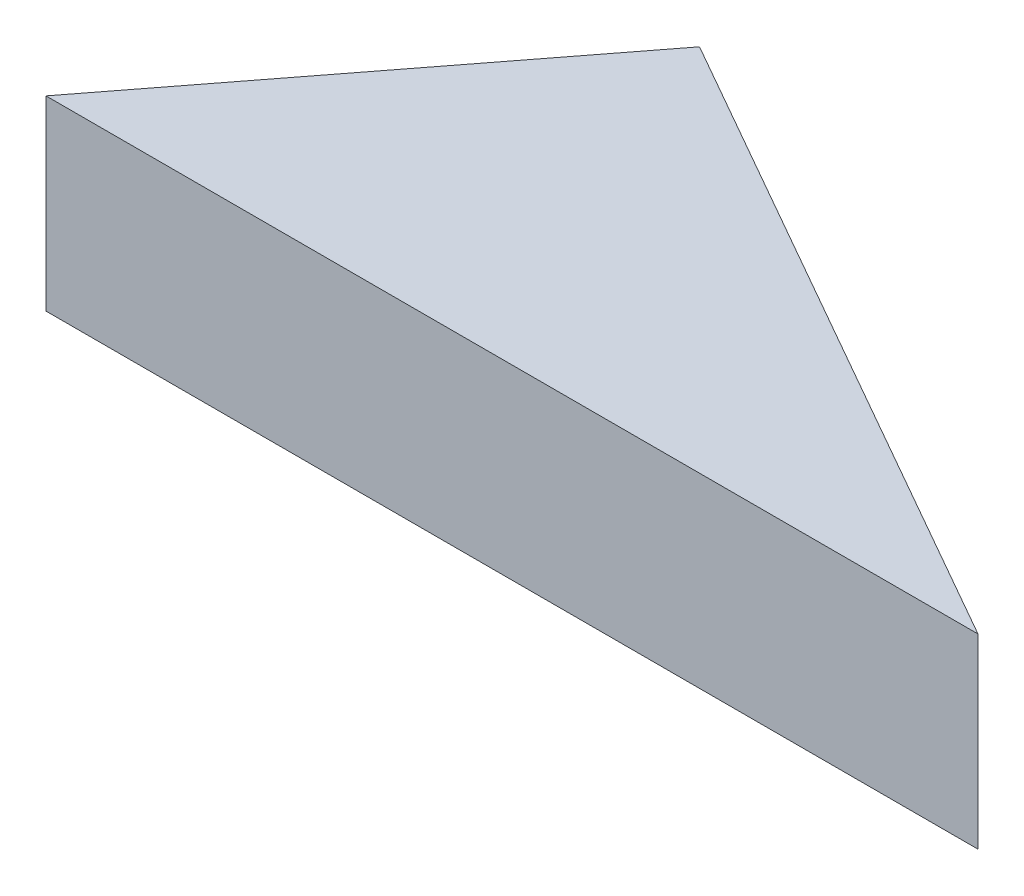
from build123d import *

# Parameters (mm, degrees)
BOSS_EXTRUDE1_DEPTH = 10


with BuildPart() as part:
    # Sketch1 → Boss-Extrude1 (new body)
    with BuildSketch(Plane(origin=(0, 0, 0), x_dir=(1, 0, 0), z_dir=(0, 1, 0))):
        Polygon((25, 0), (-25, 0), (-9.75, 19.810035336), align=None)
    extrude(amount=BOSS_EXTRUDE1_DEPTH)


solid = part.part
